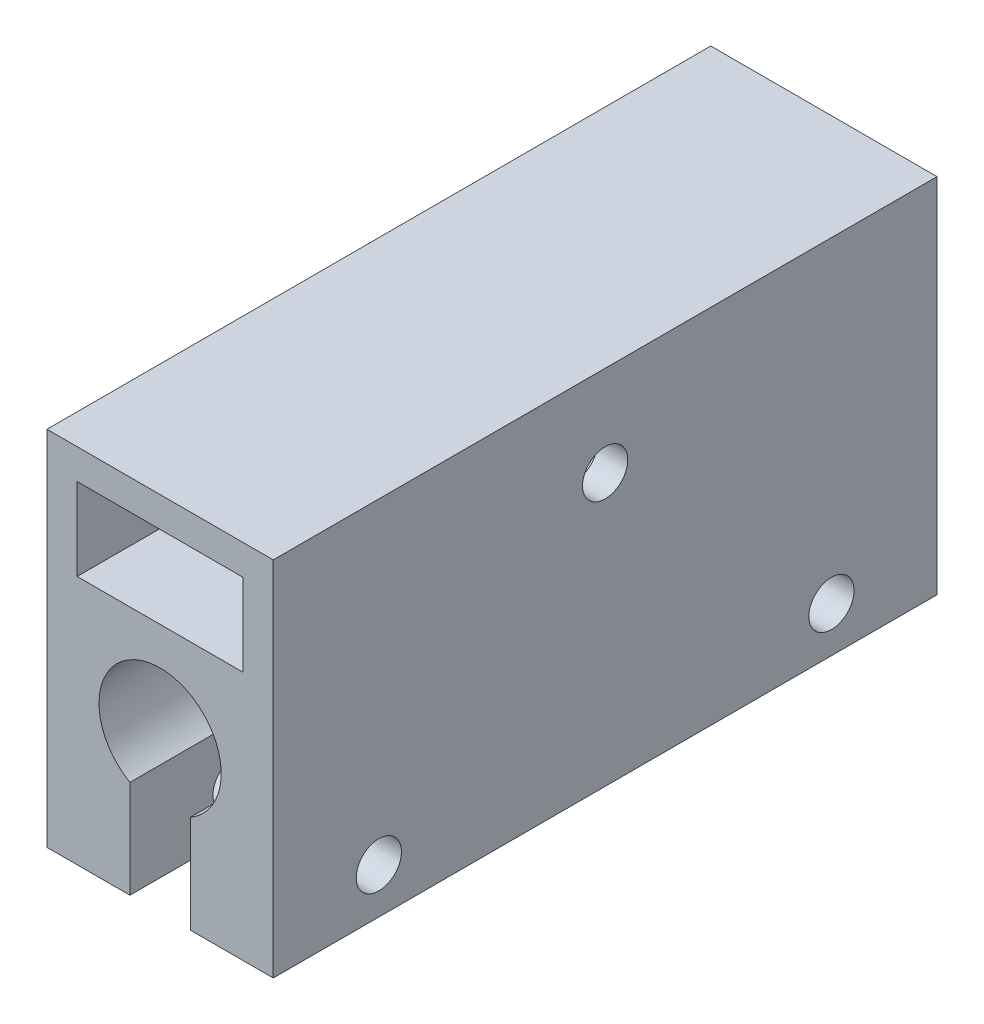
from build123d import *

# Parameters (mm, degrees)
SKETCH_1_W          = 11
SKETCH_1_H          = 5.45
EXTRUDE_1_DEPTH     = 44
SKETCH_3_R          = 1.5
CUT_EXTRUDE_2_DEPTH = 49.548944376


with BuildPart() as part:
    # 草图1 → 凸台-拉伸1 (new body)
    with BuildSketch(Plane.XY):
        with BuildLine():
            Line((2, -10), (7.5, -10))
            Line((7.5, -10), (7.5, 14))
            Line((7.5, 14), (-7.5, 14))
            Line((-7.5, 14), (-7.5, -10))
            Line((-7.5, -10), (-2, -10))
            Line((-2, -10), (-2, -3.521718331))
            ThreePointArc((-2, -3.521718331), (0, 4.05), (2, -3.521718331))
            Line((2, -3.521718331), (2, -10))
        make_face()
        with Locations((0, 9.275)):
            Rectangle(SKETCH_1_W, SKETCH_1_H, mode=Mode.SUBTRACT)
    extrude(amount=EXTRUDE_1_DEPTH)

    # 草图3 → 切除-拉伸2 (cut, through all)
    with BuildSketch(Plane.ZY.offset(7.5)):
        with Locations((7, -7)):
            Circle(SKETCH_3_R)
        with Locations((37, -7)):
            Circle(SKETCH_3_R)
        with Locations((22, 8)):
            Circle(SKETCH_3_R)
    extrude(amount=-CUT_EXTRUDE_2_DEPTH, mode=Mode.SUBTRACT)


solid = part.part
